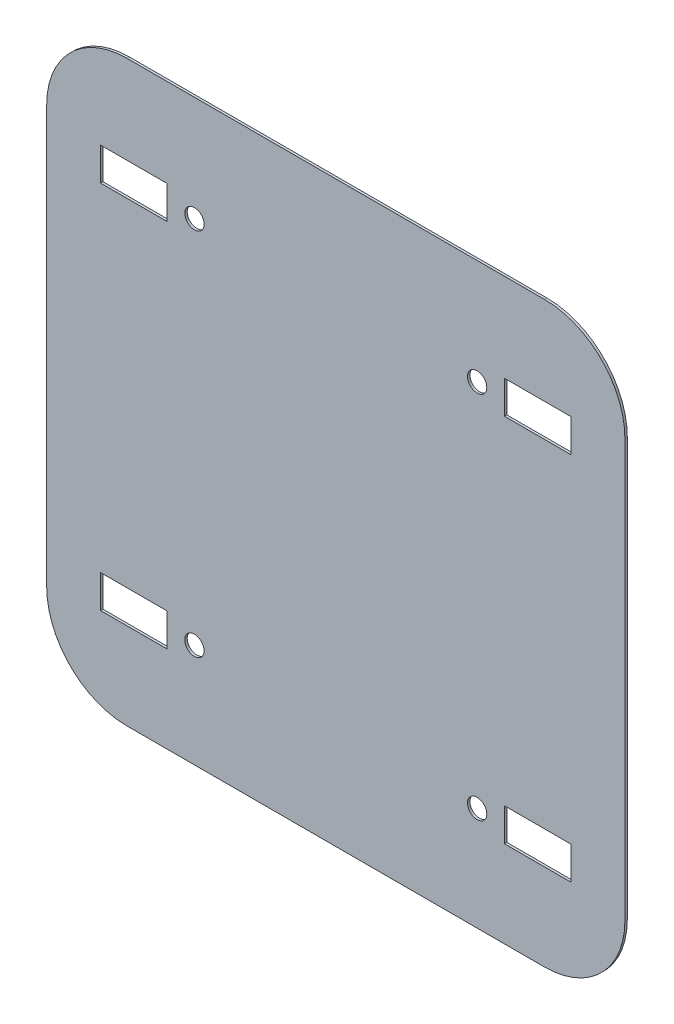
from build123d import *

# Parameters (mm, degrees)
BOSS_EXTRUDE1_DEPTH    = 1.5
SKETCH2_W              = 41.5
SKETCH2_H              = 20.5
CUT_EXTRUDE1_DEPTH     = 1.5
F_12_0MM_DOWEL_HOLE1_D = 12


with BuildPart() as part:
    # Sketch1 → Boss-Extrude1 (new body)
    with BuildSketch(Plane.XY):
        with BuildLine():
            Line((50, 0), (310, 0))
            ThreePointArc((310, 0), (345.355339059, 14.644660941), (360, 50))
            Line((360, 50), (360, 310))
            ThreePointArc((360, 310), (345.355339059, 345.355339059), (310, 360))
            Line((310, 360), (50, 360))
            ThreePointArc((50, 360), (14.644660941, 345.355339059), (0, 310))
            Line((0, 310), (0, 50))
            ThreePointArc((0, 50), (14.644660941, 14.644660941), (50, 0))
        make_face()
    extrude(amount=BOSS_EXTRUDE1_DEPTH)

    # Sketch2 → Cut-Extrude1 (cut)
    with BuildSketch(Plane.XY.offset(1.5)):
        with Locations((54.25, 294.75)):
            Rectangle(SKETCH2_W, SKETCH2_H)
        with Locations((305.75, 294.75)):
            Rectangle(SKETCH2_W, SKETCH2_H)
        with Locations((305.75, 64.25)):
            Rectangle(SKETCH2_W, SKETCH2_H)
        with Locations((54.25, 64.25)):
            Rectangle(SKETCH2_W, SKETCH2_H)
    extrude(amount=-CUT_EXTRUDE1_DEPTH, mode=Mode.SUBTRACT)

    # Ø12.0mm Dowel Hole1 (through all)
    with Locations(Plane(origin=(92, 294.5, 1.5), x_dir=(1, 0, 0), z_dir=(0, 0, 1))):
        with Locations((0, 0), (176, 0), (176, -230), (0, -230)):
            Hole(F_12_0MM_DOWEL_HOLE1_D / 2)


solid = part.part
